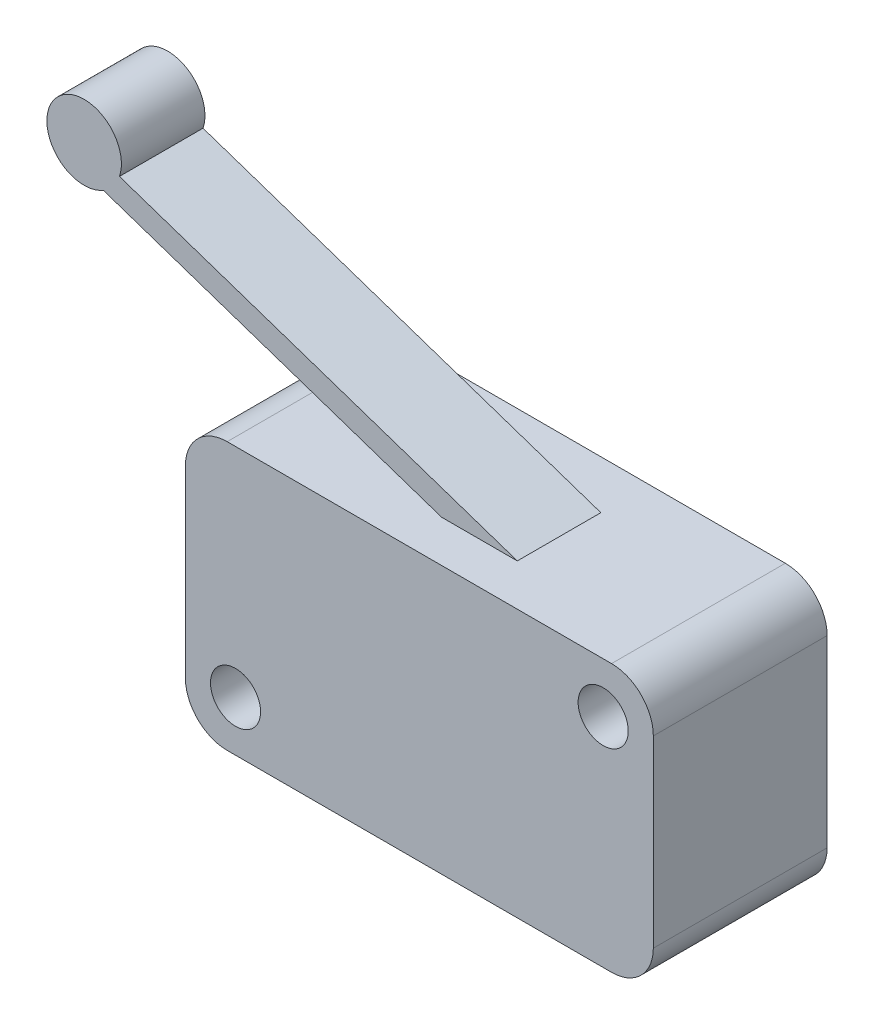
from build123d import *

# Parameters (mm, degrees)
SZKIC1_W                    = 28
SZKIC1_H                    = 16
DODANIE_WYCI_GNI_CIE1_DEPTH = 10.4
SZKIC2_R                    = 1.5
WYTNIJ_WYCI_GNI_CIE1_DEPTH  = 10.4
ZAOKR_GLENIE1_R             = 2.5
DODANIE_WYCI_GNI_CIE2_START = -2.5
DODANIE_WYCI_GNI_CIE2_DEPTH = 5
SZKIC5_R                    = 2.229172114
DODANIE_WYCI_GNI_CIE3_DEPTH = 5


with BuildPart() as part:
    # Szkic1 → Dodanie-wyciągnięcie1 (new body)
    with BuildSketch(Plane.XY):
        with Locations((14, 8)):
            Rectangle(SZKIC1_W, SZKIC1_H)
    extrude(amount=DODANIE_WYCI_GNI_CIE1_DEPTH)

    # Szkic2 → Wytnij-wyciągnięcie1 (cut)
    with BuildSketch(Plane.XY.offset(10.4)):
        with Locations((3, 3)):
            Circle(SZKIC2_R)
        with Locations((25, 13)):
            Circle(SZKIC2_R)
    extrude(amount=-WYTNIJ_WYCI_GNI_CIE1_DEPTH, mode=Mode.SUBTRACT)

    # Zaokrąglenie1
    zaokr_glenie1_edges = [part.edges().sort_by_distance(p)[0] for p in [
        (0, 16, 5.2),
        (28, 16, 5.2),
        (28, 0, 5.2),
        (0, 0, 5.2),
    ]]
    fillet(zaokr_glenie1_edges, radius=ZAOKR_GLENIE1_R)

    # Szkic4 → Dodanie-wyciągnięcie2 (add)
    with BuildSketch(Plane.XY.offset(10.4).offset(DODANIE_WYCI_GNI_CIE2_START)):
        Polygon((17.360184227, 16), (-9.374532536, 25.006750185), (-9.835766296, 23.637671029), (15.248549739, 15.186929991), align=None)
    extrude(amount=-DODANIE_WYCI_GNI_CIE2_DEPTH)

    # Szkic5 → Dodanie-wyciągnięcie3 (add)
    with BuildSketch(Plane.XY.offset(7.9)):
        with Locations((-8.559972621, 24.732330309)):
            Circle(SZKIC5_R)
    extrude(amount=-DODANIE_WYCI_GNI_CIE3_DEPTH)


solid = part.part
